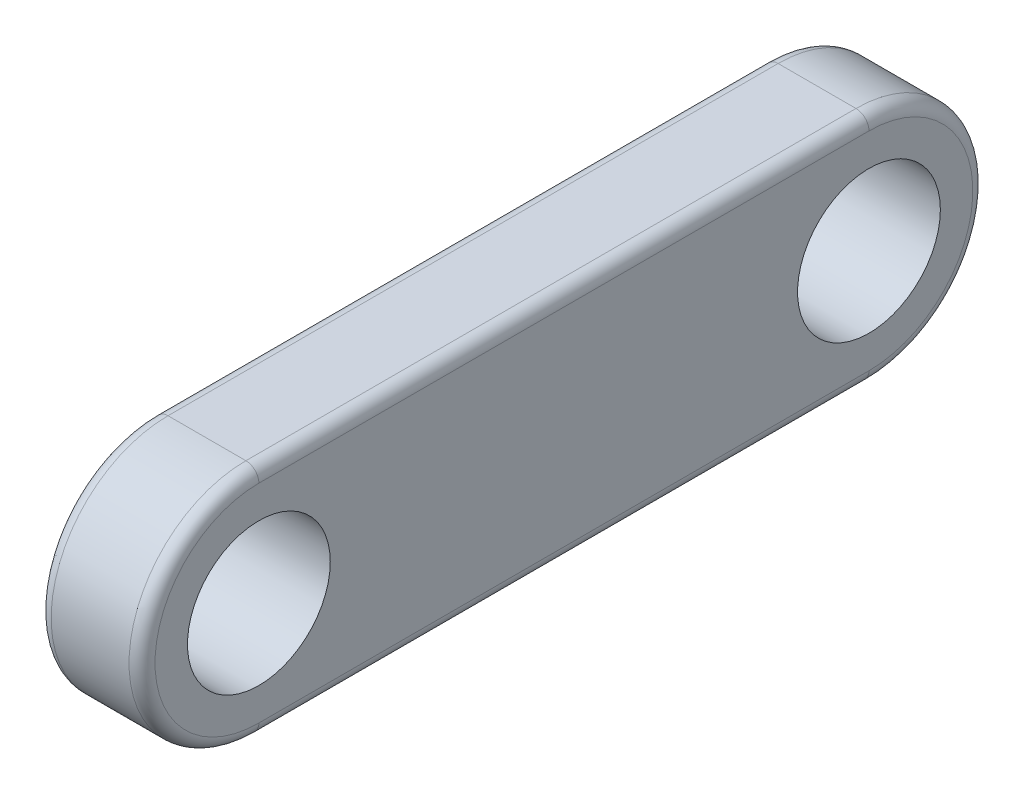
from build123d import *

# Parameters (mm, degrees)
CROQUIS1_R              = 2.75
SALIENTE_EXTRUIR4_DEPTH = 2
REDONDEO1_R             = 0.5


with BuildPart() as part:
    # Croquis1 → Saliente-Extruir4 (new, symmetric)
    with BuildSketch(Plane.YZ):
        with BuildLine():
            ThreePointArc((0, 32.5), (-3.181980515, 31.181980515), (-4.5, 28))
            Line((-4.5, 28), (-4.5, 15))
            Line((-4.5, 15), (-4.5, 9))
            Line((-4.5, 9), (-4.5, 4.5))
            ThreePointArc((-4.5, 4.5), (-3.181980515, 1.318019485), (0, 0))
            ThreePointArc((0, 0), (3.181980515, 1.318019485), (4.5, 4.5))
            Line((4.5, 4.5), (4.5, 9))
            Line((4.5, 9), (4.5, 15))
            Line((4.5, 15), (4.5, 28))
            ThreePointArc((4.5, 28), (3.181980515, 31.181980515), (0, 32.5))
        make_face()
        with Locations(Location((0, 4.5, 0), (0, 0, 270))):
            Circle(CROQUIS1_R, mode=Mode.SUBTRACT)
        with Locations(Location((0, 28, 0), (0, 0, 270))):
            Circle(CROQUIS1_R, mode=Mode.SUBTRACT)
    extrude(amount=SALIENTE_EXTRUIR4_DEPTH, both=True)

    # Redondeo1
    redondeo1_edges = [part.edges().sort_by_distance(p)[0] for p in [
        (-2, -4.5, 16.25),
        (2, -4.5, 16.25),
        (2, 0, 0),
        (2, 4.5, 16.25),
        (2, 0, 32.5),
        (-2, 0, 32.5),
        (-2, 4.5, 16.25),
        (-2, 0, 0),
    ]]
    fillet(redondeo1_edges, radius=REDONDEO1_R)


solid = part.part
